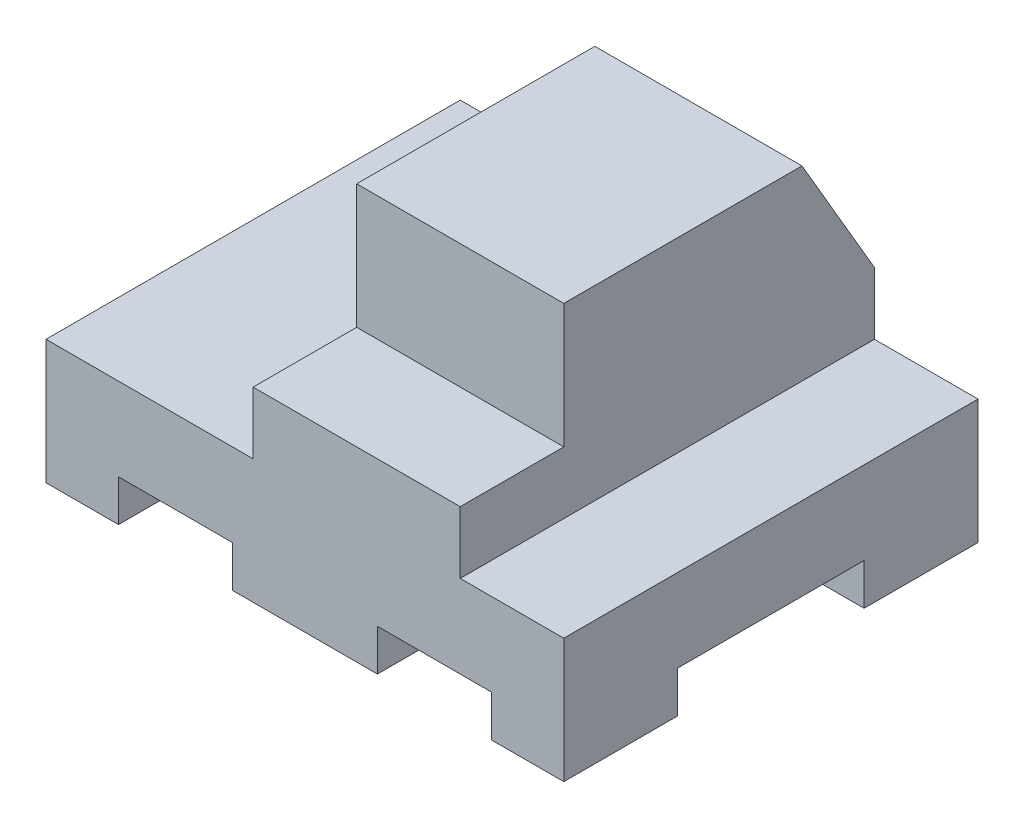
from build123d import *

# Parameters (mm, degrees)
EXTRUDE_1_DEPTH     = 40
SKETCH_2_W          = 18
SKETCH_2_H          = 4
CUT_EXTRUDE_1_DEPTH = 66.76473219
SKETCH_3_W          = 11
SKETCH_3_H          = 4
CUT_EXTRUDE_2_DEPTH = 50.497474683
SKETCH_4_W          = 10
SKETCH_4_H          = 12
CUT_EXTRUDE_3_DEPTH = 59.523499554


with BuildPart() as part:
    # Эскиз1 → Бобышка-Вытянуть1 (new body)
    with BuildSketch(Plane.XY):
        Polygon((-5, -3), (-25, -3), (-25, -15), (25, -15), (25, -3), (15, -3), (15, 15), (-5, 15), align=None)
    extrude(amount=EXTRUDE_1_DEPTH)

    # Эскиз2 → Вырез-Вытянуть1 (cut, through all)
    with BuildSketch(Plane.ZY.offset(25)):
        with Locations((20, -13)):
            Rectangle(SKETCH_2_W, SKETCH_2_H)
    extrude(amount=-CUT_EXTRUDE_1_DEPTH, mode=Mode.SUBTRACT)

    # Эскиз3 → Вырез-Вытянуть2 (cut, through all)
    with BuildSketch(Plane.XY.offset(40)):
        with Locations((-12.5, -13)):
            Rectangle(SKETCH_3_W, SKETCH_3_H)
    cut_extrude_2 = extrude(amount=-CUT_EXTRUDE_2_DEPTH, mode=Mode.SUBTRACT)

    # Зеркальное отражение1: Вырез-Вытянуть2 across plane
    add(cut_extrude_2.mirror(Plane(origin=(0, 0, 0), x_dir=(0, 0, 1), z_dir=(1, 0, 0))), mode=Mode.SUBTRACT)

    # Эскиз4 → Вырез-Вытянуть3 (cut, through all)
    with BuildSketch(Plane(origin=(15, 0, 0), x_dir=(0, 0, -1), z_dir=(1, 0, 0))):
        Polygon((-7, 15), (0, 3), (0, 15), align=None)
        with Locations((-35, 9)):
            Rectangle(SKETCH_4_W, SKETCH_4_H)
    extrude(amount=-CUT_EXTRUDE_3_DEPTH, mode=Mode.SUBTRACT)


solid = part.part
